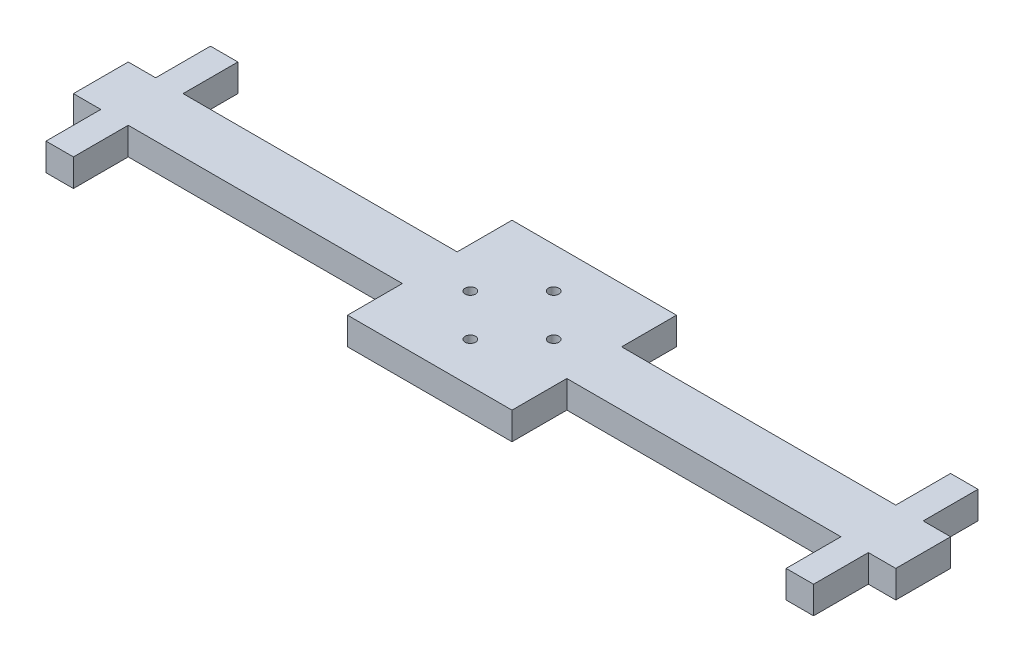
from build123d import *

# Parameters (mm, degrees)
SKETCH1_R           = 1.2065
BOSS_EXTRUDE1_DEPTH = 6.35


with BuildPart() as part:
    # Sketch1 → Boss-Extrude1 (new body)
    with BuildSketch(Plane(origin=(0, 0, 0), x_dir=(1, 0, 0), z_dir=(0, 1, 0))):
        Polygon((0, 0), (0, 12.7), (6.35, 12.7), (6.35, 25.4), (12.7, 25.4), (12.7, 12.7), (76.2, 12.7), (76.2, 25.4), (114.3, 25.4), (114.3, 12.7), (177.8, 12.7), (177.8, 25.4), (184.15, 25.4), (184.15, 12.7), (190.5, 12.7), (190.5, 0), (184.15, 0), (184.15, -12.7), (177.8, -12.7), (177.8, 0), (114.3, 0), (114.3, -12.7), (76.2, -12.7), (76.2, 0), (12.7, 0), (12.7, -12.7), (6.35, -12.7), (6.35, 0), align=None)
        with Locations(Location((85.598, 6.35, 0), (0, 0, 270))):
            Circle(SKETCH1_R, mode=Mode.SUBTRACT)
        with Locations(Location((104.902, 6.35, 0), (0, 0, 270))):
            Circle(SKETCH1_R, mode=Mode.SUBTRACT)
        with Locations(Location((95.25, 16.002, 0), (0, 0, 270))):
            Circle(SKETCH1_R, mode=Mode.SUBTRACT)
        with Locations(Location((95.25, -3.302, 0), (0, 0, 270))):
            Circle(SKETCH1_R, mode=Mode.SUBTRACT)
    extrude(amount=BOSS_EXTRUDE1_DEPTH)


solid = part.part
